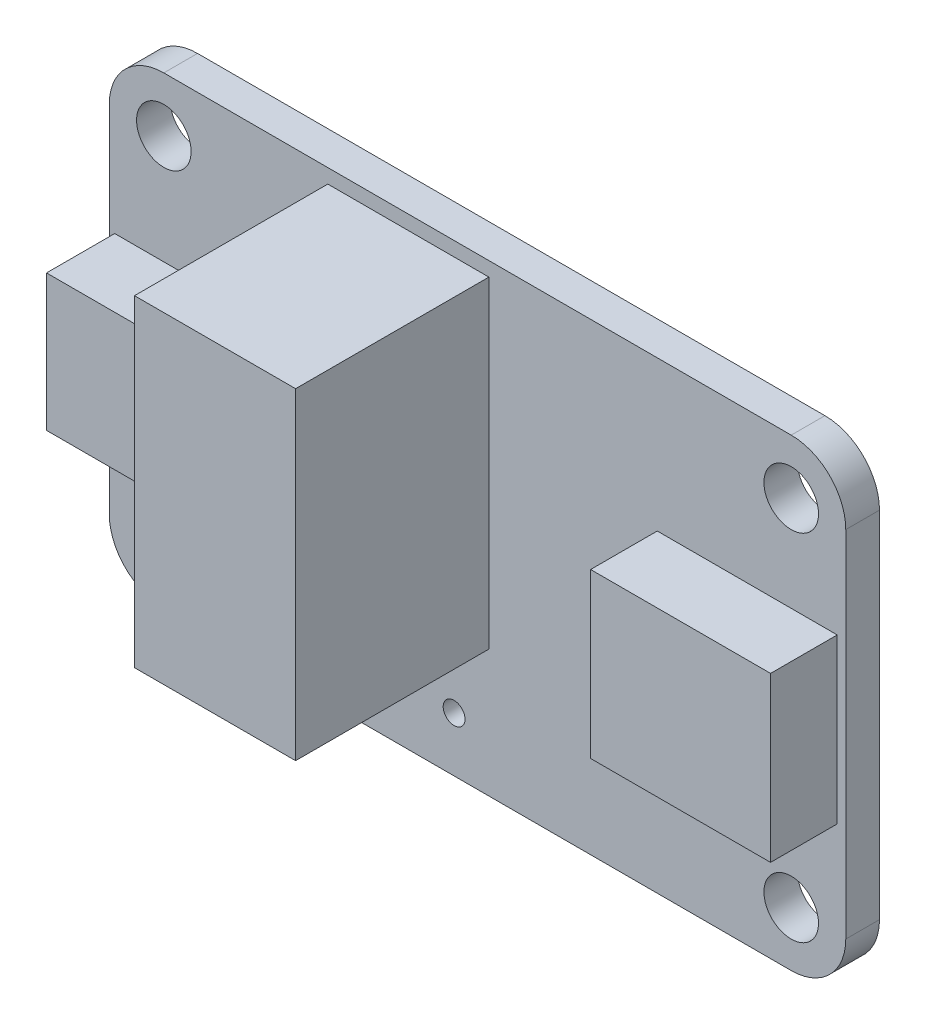
from build123d import *

# Parameters (mm, degrees)
SKETCH1_W           = 34.29
SKETCH1_H           = 21.59
SKETCH1_R           = 1.27
SKETCH1_R_2         = 0.508
BOSS_EXTRUDE1_DEPTH = 1.5699994
FILLET1_R           = 2.54
SKETCH2_W           = 7.5
SKETCH2_H           = 15
BOSS_EXTRUDE2_DEPTH = 9
SKETCH3_W           = 4.699
SKETCH3_H           = 6.35
BOSS_EXTRUDE3_DEPTH = 3.175
SKETCH4_W           = 2.667
SKETCH4_H           = 5.842
CUT_EXTRUDE1_DEPTH  = 3.175
SKETCH6_W           = 8.378747874
SKETCH6_H           = 3.102965804
BOSS_EXTRUDE4_DEPTH = 3.81


with BuildPart() as part:
    # Sketch1 → Boss-Extrude1 (new body)
    with BuildSketch(Plane.XY):
        Rectangle(SKETCH1_W, SKETCH1_H)
        with Locations((-14.605, 8.255)):
            Circle(SKETCH1_R, mode=Mode.SUBTRACT)
        with Locations((-14.605, -8.255)):
            Circle(SKETCH1_R, mode=Mode.SUBTRACT)
        with Locations((14.605, -8.255)):
            Circle(SKETCH1_R, mode=Mode.SUBTRACT)
        with Locations((14.605, 8.255)):
            Circle(SKETCH1_R, mode=Mode.SUBTRACT)
        with Locations((-6.169791694, -8.255)):
            Circle(SKETCH1_R_2, mode=Mode.SUBTRACT)
        with Locations((-3.629791694, -8.255)):
            Circle(SKETCH1_R_2, mode=Mode.SUBTRACT)
        with Locations((-1.089791694, -8.255)):
            Circle(SKETCH1_R_2, mode=Mode.SUBTRACT)
    extrude(amount=BOSS_EXTRUDE1_DEPTH)

    # Fillet1
    fillet1_edges = [part.edges().sort_by_distance(p)[0] for p in [
        (17.145, -10.795, 0.7849997),
        (-17.145, -10.795, 0.7849997),
        (-17.145, 10.795, 0.7849997),
        (17.145, 10.795, 0.7849997),
    ]]
    fillet(fillet1_edges, radius=FILLET1_R)

    # Sketch2 → Boss-Extrude2 (add)
    with BuildSketch(Plane.XY.offset(1.5699994)):
        with Locations((-3.219698951, 2.629795429)):
            Rectangle(SKETCH2_W, SKETCH2_H)
    extrude(amount=BOSS_EXTRUDE2_DEPTH)

    # Sketch3 → Boss-Extrude3 (add)
    with BuildSketch(Plane.XY.offset(1.5699994)):
        with Locations((-14.5415, 0)):
            Rectangle(SKETCH3_W, SKETCH3_H)
    extrude(amount=BOSS_EXTRUDE3_DEPTH)

    # Sketch4 → Cut-Extrude1 (cut)
    with BuildSketch(Plane.ZY.offset(16.891)):
        with Locations((3.1574994, 0)):
            Rectangle(SKETCH4_W, SKETCH4_H)
    extrude(amount=-CUT_EXTRUDE1_DEPTH, mode=Mode.SUBTRACT)

    # Sketch6 → Boss-Extrude4 (add, symmetric)
    with BuildSketch(Plane(origin=(0, 0, 0), x_dir=(1, 0, 0), z_dir=(0, 1, 0))):
        with Locations((12.558008878, -3.121482302)):
            Rectangle(SKETCH6_W, SKETCH6_H)
    extrude(amount=BOSS_EXTRUDE4_DEPTH, both=True)


solid = part.part
